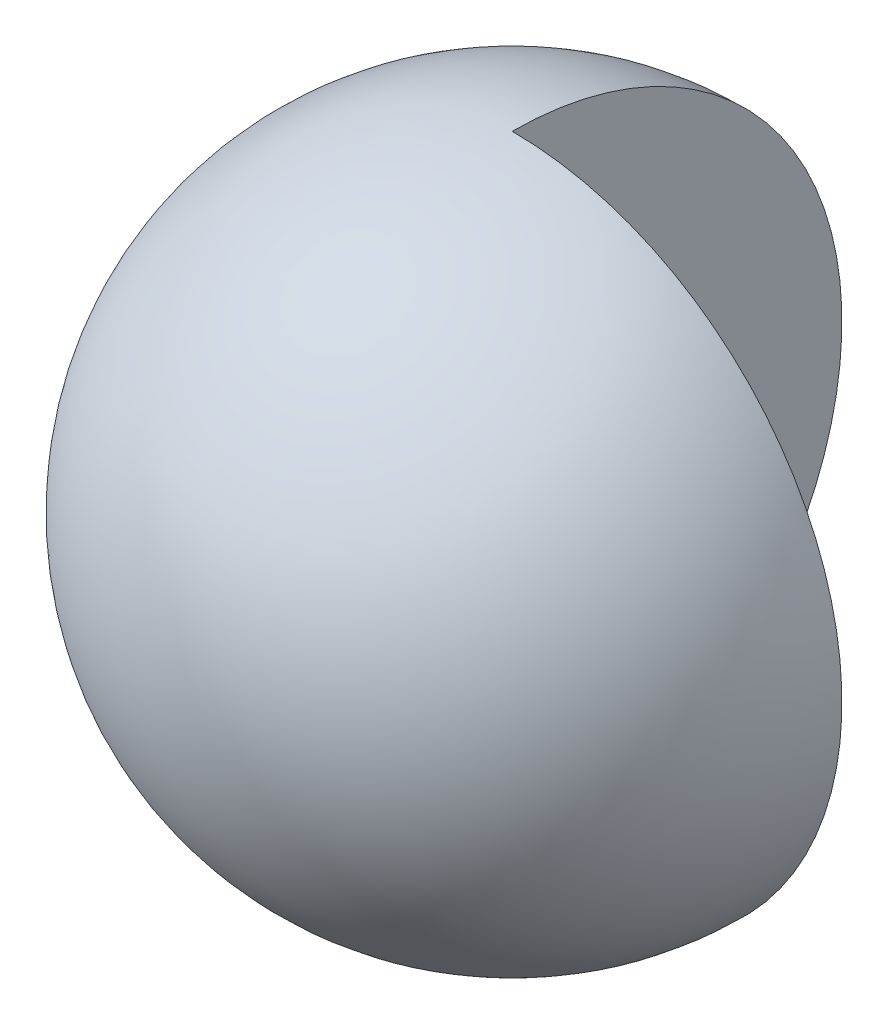
from build123d import *

# Parameters (mm, degrees)
REVOLVE4_ANGLE = 270


with BuildPart() as part:
    # Sketch1 → Revolve4 (revolve)
    with BuildSketch(Plane.XY):
        with BuildLine():
            Line((0, 29.854351051), (0, -29.854351051))
            ThreePointArc((0, -29.854351051), (29.854351051, 0), (0, 29.854351051))
        make_face()
    revolve(axis=Axis((0, 29.854351051, 0), (0, -1, 0)), revolution_arc=REVOLVE4_ANGLE)


solid = part.part
